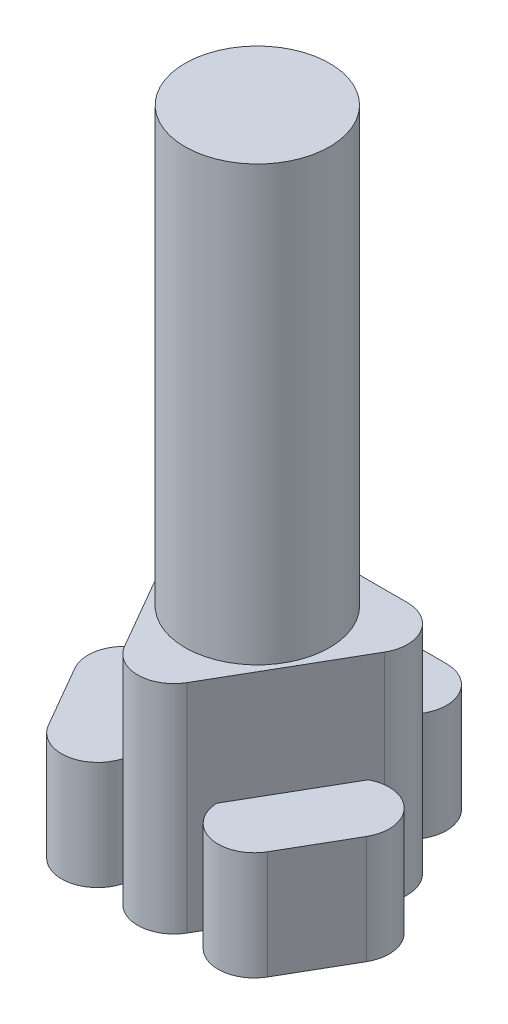
from build123d import *

# Parameters (mm, degrees)
BOSS_EXTRUDE1_DEPTH   = 0.6
BOSS_EXTRUDE2_DEPTH   = 0.3
BOSS_EXTRUDE2_2_DEPTH = 0.3
BOSS_EXTRUDE2_3_DEPTH = 0.3
SKETCH3_R             = 0.2
BOSS_EXTRUDE3_DEPTH   = 1.2


with BuildPart() as part:
    # Sketch1 → Boss-Extrude1 (new body)
    with BuildSketch(Plane(origin=(0, 0, 0), x_dir=(1, 0, 0), z_dir=(0, 1, 0))):
        with BuildLine():
            Line((0.28660254, 0.065470054), (0.08660254, -0.280940108))
            ThreePointArc((0.08660254, -0.280940108), (0, -0.330940108), (-0.08660254, -0.280940108))
            Line((-0.08660254, -0.280940108), (-0.28660254, 0.065470054))
            ThreePointArc((-0.28660254, 0.065470054), (-0.28660254, 0.165470054), (-0.2, 0.215470054))
            Line((-0.2, 0.215470054), (0.2, 0.215470054))
            ThreePointArc((0.2, 0.215470054), (0.28660254, 0.165470054), (0.28660254, 0.065470054))
        make_face()
    extrude(amount=BOSS_EXTRUDE1_DEPTH)

    # Sketch3 → Boss-Extrude3 (add)
    with BuildSketch(Plane(origin=(0, 0.6, 0), x_dir=(1, 0, 0), z_dir=(0, 1, 0))):
        with Locations(Location((0, 0, 0), (0, 0, 270))):
            Circle(SKETCH3_R)
    extrude(amount=BOSS_EXTRUDE3_DEPTH)


with BuildPart() as body_2:
    # Sketch2 → Boss-Extrude2 (new body)
    with BuildSketch(Plane(origin=(0, 0, 0), x_dir=(1, 0, 0), z_dir=(0, 1, 0))):
        with BuildLine():
            Line((0.403108891, -0.101794919), (0.303108891, -0.275))
            ThreePointArc((0.303108891, -0.275), (0.166506351, -0.31160254), (0.129903811, -0.175))
            Line((0.129903811, -0.175), (0.229903811, -0.001794919))
            ThreePointArc((0.229903811, -0.001794919), (0.366506351, 0.034807621), (0.403108891, -0.101794919))
        make_face()
    extrude(amount=BOSS_EXTRUDE2_DEPTH)


with BuildPart() as body_3:
    # Sketch2 → Boss-Extrude2 2 (new body)
    with BuildSketch(Plane(origin=(0, 0, 0), x_dir=(1, 0, 0), z_dir=(0, 1, 0))):
        with BuildLine():
            Line((0.1, 0.423205081), (-0.1, 0.423205081))
            ThreePointArc((-0.1, 0.423205081), (-0.2, 0.323205081), (-0.1, 0.223205081))
            Line((-0.1, 0.223205081), (0.1, 0.223205081))
            ThreePointArc((0.1, 0.223205081), (0.2, 0.323205081), (0.1, 0.423205081))
        make_face()
    extrude(amount=BOSS_EXTRUDE2_2_DEPTH)


with BuildPart() as body_4:
    # Sketch2 → Boss-Extrude2 3 (new body)
    with BuildSketch(Plane(origin=(0, 0, 0), x_dir=(1, 0, 0), z_dir=(0, 1, 0))):
        with BuildLine():
            Line((-0.303108891, -0.275), (-0.403108891, -0.101794919))
            ThreePointArc((-0.403108891, -0.101794919), (-0.366506351, 0.034807621), (-0.229903811, -0.001794919))
            Line((-0.229903811, -0.001794919), (-0.129903811, -0.175))
            ThreePointArc((-0.129903811, -0.175), (-0.166506351, -0.31160254), (-0.303108891, -0.275))
        make_face()
    extrude(amount=BOSS_EXTRUDE2_3_DEPTH)


solid = Compound([part.part, body_2.part, body_3.part, body_4.part])
